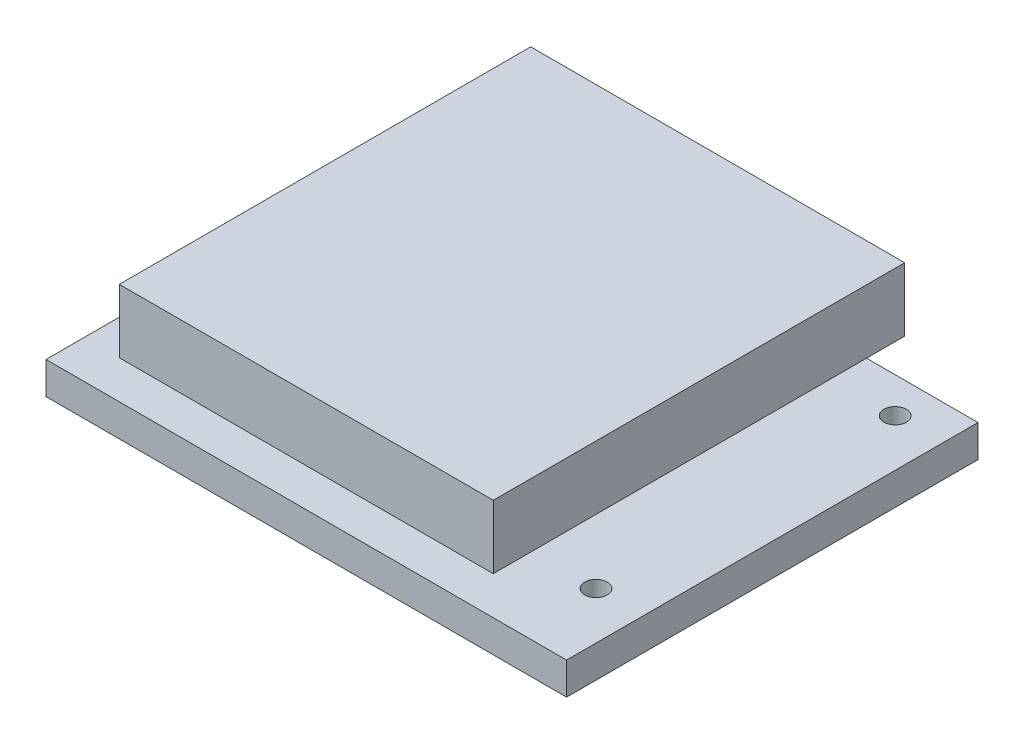
from build123d import *

# Parameters (mm, degrees)
SKETCH1_W           = 69.6
SKETCH1_H           = 55
SKETCH1_R           = 1.5
BOSS_EXTRUDE1_DEPTH = 4.3
SKETCH3_W           = 50
SKETCH3_H           = 55
BOSS_EXTRUDE2_DEPTH = 1.5
SKETCH5_W           = 50
SKETCH5_H           = 55
BOSS_EXTRUDE3_DEPTH = 7


with BuildPart() as part:
    # Sketch1 → Boss-Extrude1 (new body)
    with BuildSketch(Plane(origin=(0, 0, 0), x_dir=(1, 0, 0), z_dir=(0, 1, 0))):
        Rectangle(SKETCH1_W, SKETCH1_H)
        with Locations(Location((28.47912844, 22.75, 0), (0, 0, 90))):
            Circle(SKETCH1_R, mode=Mode.SUBTRACT)
        with Locations(Location((28.47912844, -17.25, 0), (0, 0, 90))):
            Circle(SKETCH1_R, mode=Mode.SUBTRACT)
        with Locations(Location((-28.47912844, -17.25, 0), (0, 0, 90))):
            Circle(SKETCH1_R, mode=Mode.SUBTRACT)
        with Locations(Location((-28.47912844, 22.75, 0), (0, 0, 90))):
            Circle(SKETCH1_R, mode=Mode.SUBTRACT)
    extrude(amount=BOSS_EXTRUDE1_DEPTH)


with BuildPart() as body_2:
    # Sketch3 → Boss-Extrude2 (new body)
    with BuildSketch(Plane(origin=(0, 9.4, 0), x_dir=(1, 0, 0), z_dir=(0, 1, 0))):
        Rectangle(SKETCH3_W, SKETCH3_H)
    extrude(amount=BOSS_EXTRUDE2_DEPTH)

    # Sketch5 → Boss-Extrude3 (add)
    with BuildSketch(Plane(origin=(0, 10.9, 0), x_dir=(1, 0, 0), z_dir=(0, 1, 0))):
        Rectangle(SKETCH5_W, SKETCH5_H)
    extrude(amount=BOSS_EXTRUDE3_DEPTH)


solid = Compound([part.part, body_2.part])
